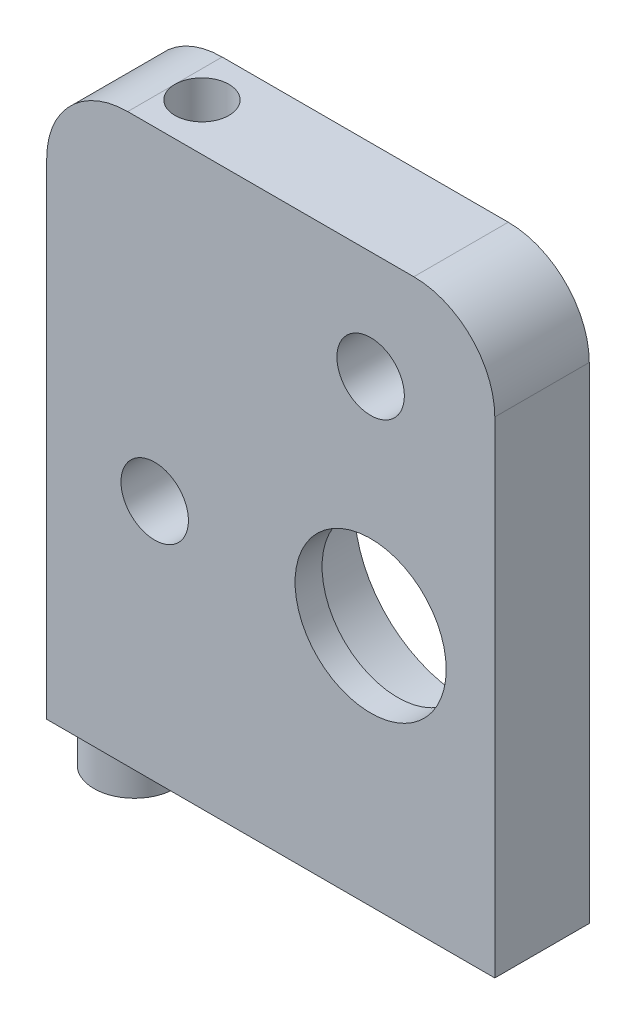
from build123d import *

# Parameters (mm, degrees)
SKETCH_1_W          = 16.6
SKETCH_1_H          = 21
SKETCH_1_R          = 4.1
SKETCH_1_R_2        = 1.25
EXTRUDE_1_DEPTH     = 3.5
EXTRUDE_START       = 2.5
SKETCH_1_3_R        = 4.1
SKETCH_1_3_R_2      = 2.8
EXTRUDE_2_DEPTH     = 1
FILLET_1_R          = 3
FILLET_2_R          = 3
SKETCH_2_R          = 1
CUT_EXTRUDE_1_DEPTH = 6
SKETCH_2_3_R        = 1.5
EXTRUDE_3_DEPTH     = 1.6
SKETCH_4_R          = 1
CUT_EXTRUDE_2_DEPTH = 6


with BuildPart() as part:
    # 草图1 → 凸台-拉伸1 (new body)
    with BuildSketch(Plane.XY):
        with Locations((-3.7, 1.5)):
            Rectangle(SKETCH_1_W, SKETCH_1_H)
        Circle(SKETCH_1_R, mode=Mode.SUBTRACT)
        with Locations((0, 8)):
            Circle(SKETCH_1_R_2, mode=Mode.SUBTRACT)
        with Locations((-8, 0)):
            Circle(SKETCH_1_R_2, mode=Mode.SUBTRACT)
    extrude(amount=EXTRUDE_1_DEPTH)

    # 草图1<3> → 凸台-拉伸2 (add)
    with BuildSketch(Plane.XY.offset(EXTRUDE_START)):
        Circle(SKETCH_1_3_R)
        Circle(SKETCH_1_3_R_2, mode=Mode.SUBTRACT)
    extrude(amount=EXTRUDE_2_DEPTH)

    # 圆角1
    fillet_1_edges = [part.edges().sort_by_distance(p)[0] for p in [
        (-12, 12, 1.75),
    ]]
    fillet(fillet_1_edges, radius=FILLET_1_R)

    # 圆角2
    fillet_2_edges = [part.edges().sort_by_distance(p)[0] for p in [
        (4.6, 12, 1.75),
    ]]
    fillet(fillet_2_edges, radius=FILLET_2_R)

    # 草图2 → 切除-拉伸1 (cut)
    with BuildSketch(Plane.XZ.offset(9)):
        with Locations(Location((-4.5, 1.75, 0), (0, 0, 270))):
            Circle(SKETCH_2_R)
    extrude(amount=-CUT_EXTRUDE_1_DEPTH, mode=Mode.SUBTRACT)

    # 草图2<3> → 凸台-拉伸3 (add)
    with BuildSketch(Plane.XZ.offset(9)):
        with Locations(Location((-10.5, 1.75, 0), (0, 0, 180))):
            Circle(SKETCH_2_3_R)
    extrude(amount=EXTRUDE_3_DEPTH)

    # 草图4 → 切除-拉伸2 (cut)
    with BuildSketch(Plane(origin=(0, 12, 0), x_dir=(1, 0, 0), z_dir=(0, 1, 0))):
        with Locations(Location((-8, -1.75, 0), (0, 0, 270))):
            Circle(SKETCH_4_R)
    extrude(amount=-CUT_EXTRUDE_2_DEPTH, mode=Mode.SUBTRACT)


solid = part.part
